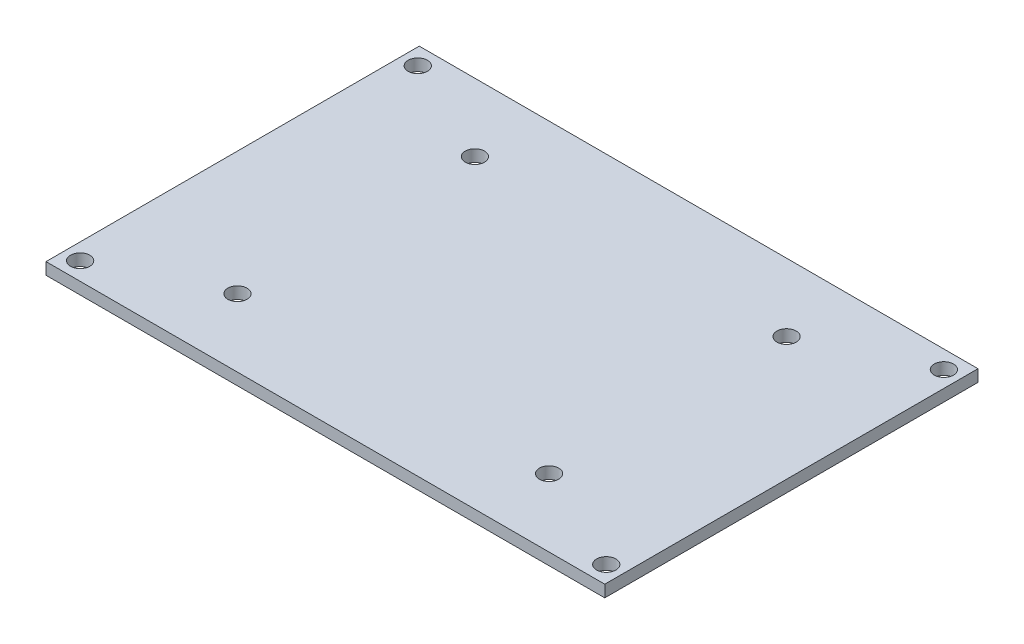
from build123d import *

# Parameters (mm, degrees)
CROQUIS7_W                   = 75.3
CROQUIS7_H                   = 50.3
SALIENTE_EXTRUIR1_DEPTH      = 1.6
TALADRO_DE_MARGEN_PARA_M23_D = 2.6
TALADRO_DE_MARGEN_PARA_M24_D = 2.6


with BuildPart() as part:
    # Croquis7 → Saliente-Extruir1 (new body)
    with BuildSketch(Plane(origin=(0, 0, 0), x_dir=(1, 0, 0), z_dir=(0, 1, 0))):
        Rectangle(CROQUIS7_W, CROQUIS7_H)
    extrude(amount=SALIENTE_EXTRUIR1_DEPTH)

    # Taladro de margen para M23 (through all)
    with Locations(Plane(origin=(0, 1.6, 0), x_dir=(1, 0, 0), z_dir=(0, 1, 0))):
        with Locations((-35.45, 22.75), (35.45, 22.75), (35.45, -22.75), (-35.45, -22.75)):
            Hole(TALADRO_DE_MARGEN_PARA_M23_D / 2)

    # Taladro de margen para M24 (through all)
    with Locations(Plane(origin=(0, 1.6, 0), x_dir=(1, 0, 0), z_dir=(0, 1, 0))):
        with Locations((-21, 16), (21, 16), (21, -16), (-21, -16)):
            Hole(TALADRO_DE_MARGEN_PARA_M24_D / 2)


solid = part.part
